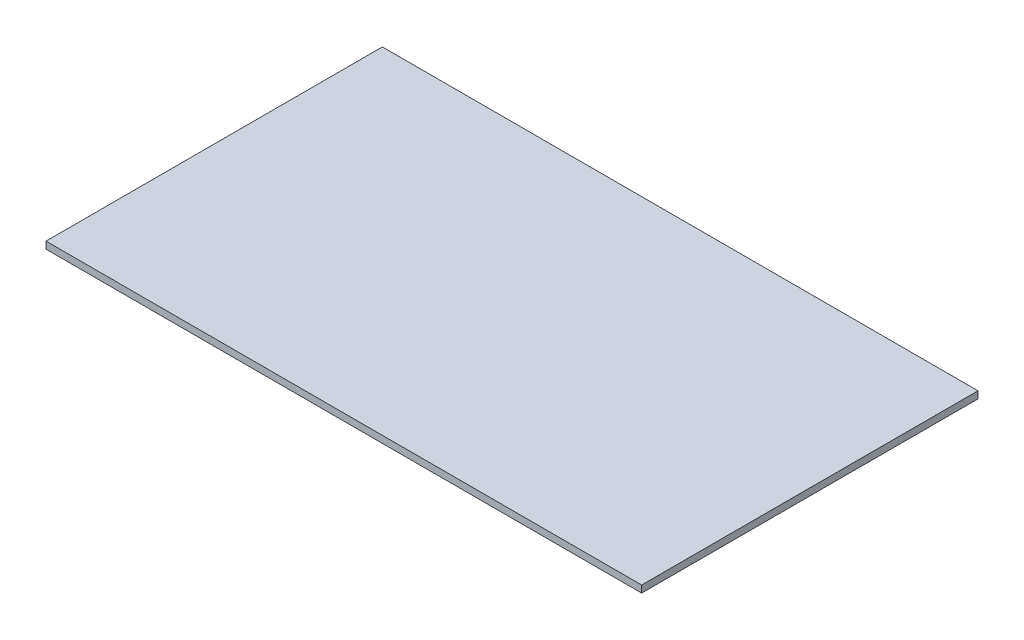
from build123d import *

# Parameters (mm, degrees)
SKETCH_1_W      = 85
SKETCH_1_H      = 48
EXTRUDE_1_DEPTH = 1


with BuildPart() as part:
    # 草图1 → 凸台-拉伸1 (new body)
    with BuildSketch(Plane(origin=(0, 0, 0), x_dir=(1, 0, 0), z_dir=(0, 1, 0))):
        Rectangle(SKETCH_1_W, SKETCH_1_H)
    extrude(amount=EXTRUDE_1_DEPTH)


solid = part.part
